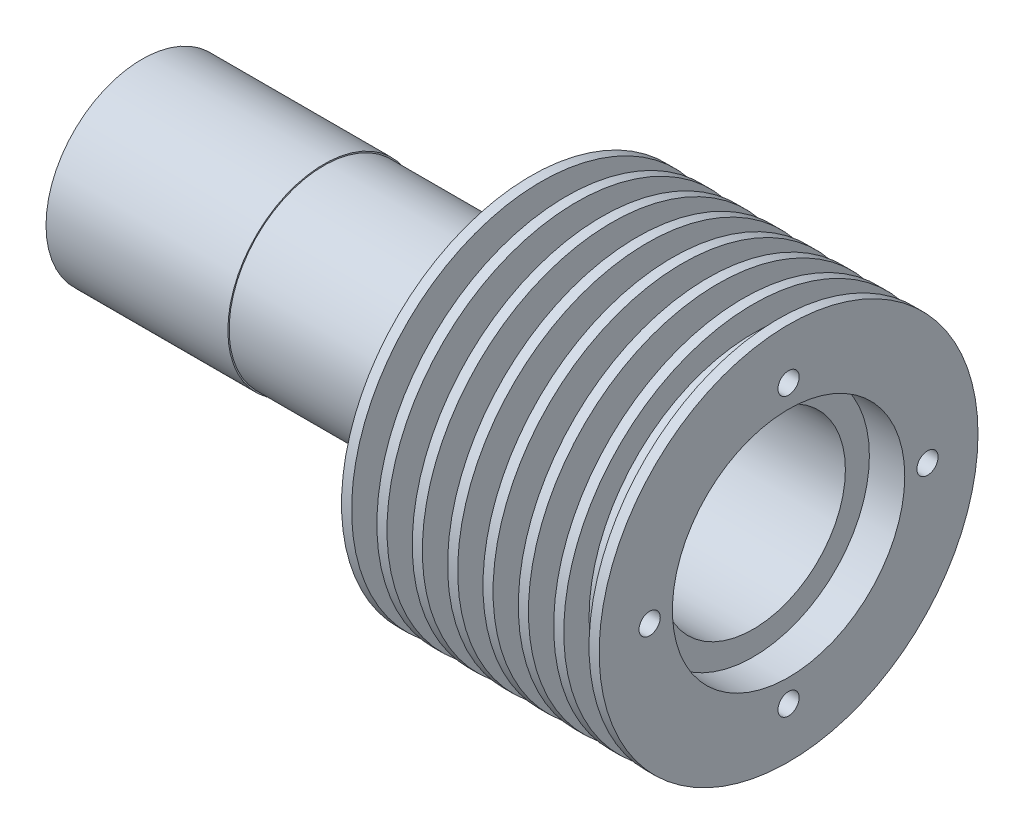
from build123d import *

# Parameters (mm, degrees)
SKETCH1_W                 = 36
SKETCH1_H                 = 0.75
M5X0_8_TAPPED_HOLE3_D     = 4.2
M5X0_8_TAPPED_HOLE3_DEPTH = 9


with BuildPart() as part:
    # Sketch1 → Revolve1 (revolve)
    with BuildSketch(Plane.XY, mode=Mode.PRIVATE) as revolve1_sk:
        with Locations((-110, 18.625)):
            Rectangle(SKETCH1_W, SKETCH1_H)
        Polygon((-92, 18.75), (-92, 18.25), (-9, 18.25), (-9, 18.75), (-14, 18.75), (-14, 37.5), (-16, 37.5), (-16, 18.75), (-21, 18.75), (-21, 37.5), (-23, 37.5), (-23, 18.75), (-28, 18.75), (-28, 37.5), (-30, 37.5), (-30, 18.75), (-35, 18.75), (-35, 37.5), (-37, 37.5), (-37, 18.75), (-42, 18.75), (-42, 37.5), (-44, 37.5), (-44, 18.75), (-49, 18.75), (-49, 37.5), (-51, 37.5), (-51, 18.75), (-56, 18.75), align=None)
        Polygon((-7, 18.25), (-9, 18.25), (-9, 37.5), (-7, 37.5), (-7, 32.5), (-2, 32.5), (-2, 37.5), (0, 37.5), (0, 23), (-7, 23), align=None)
    revolve(revolve1_sk.sketch.rotate(Axis((0, 0, 0), (-1, 0, 0)), 90), axis=Axis((0, 0, 0), (-1, 0, 0)))

    # M5x0.8 Tapped Hole3
    with Locations(Plane(origin=(0, 0, 0), x_dir=(0, 0, -1), z_dir=(1, 0, 0))):
        with Locations((0, 27.5), (-27.5, 0), (0, -27.5), (27.5, 0)):
            Hole(M5X0_8_TAPPED_HOLE3_D / 2, depth=M5X0_8_TAPPED_HOLE3_DEPTH)


solid = part.part
